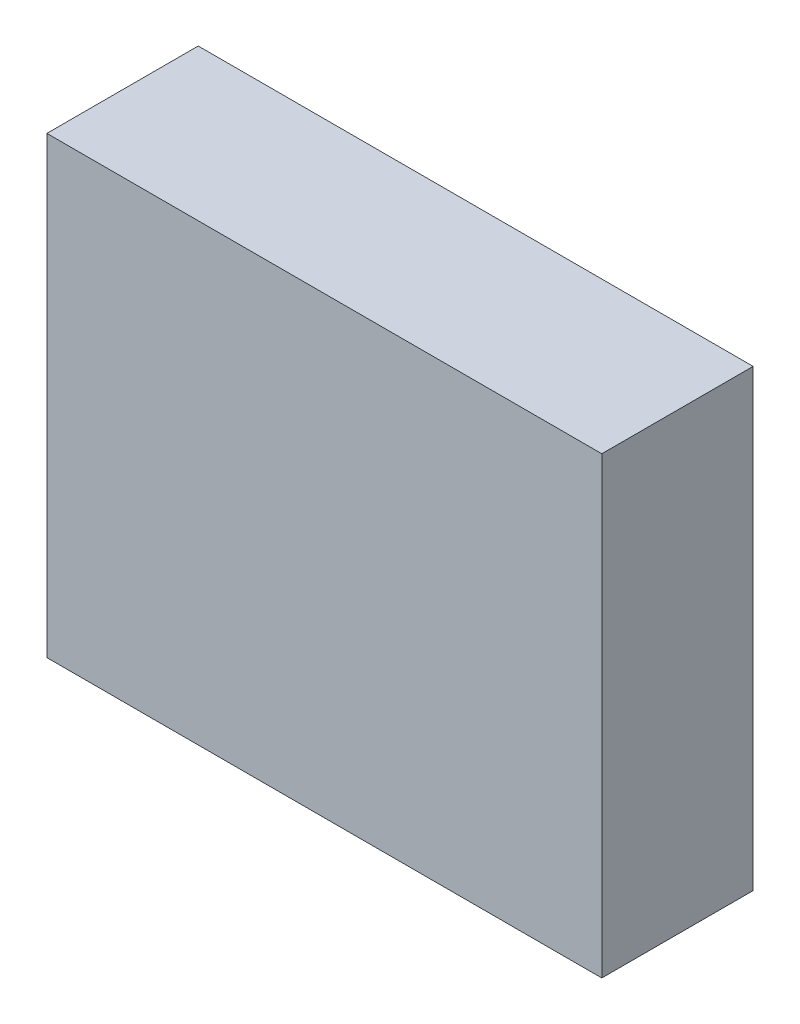
from build123d import *

# Parameters (mm, degrees)
STORE_PANO_ROLE_KARTI_1_8KANAL_1_START = -670
SKETCH1_W                              = 110
SKETCH1_H                              = 90
STORE_PANO_ROLE_KARTI_1_8KANAL_1_DEPTH = 30


with BuildPart() as part:
    # Sketch1 → STORE_pano_role_karti_1_8kanal_1 (new body)
    with BuildSketch(Plane.XY.offset(STORE_PANO_ROLE_KARTI_1_8KANAL_1_START)):
        with Locations((1045, 1735)):
            Rectangle(SKETCH1_W, SKETCH1_H)
    extrude(amount=-STORE_PANO_ROLE_KARTI_1_8KANAL_1_DEPTH)


solid = part.part
